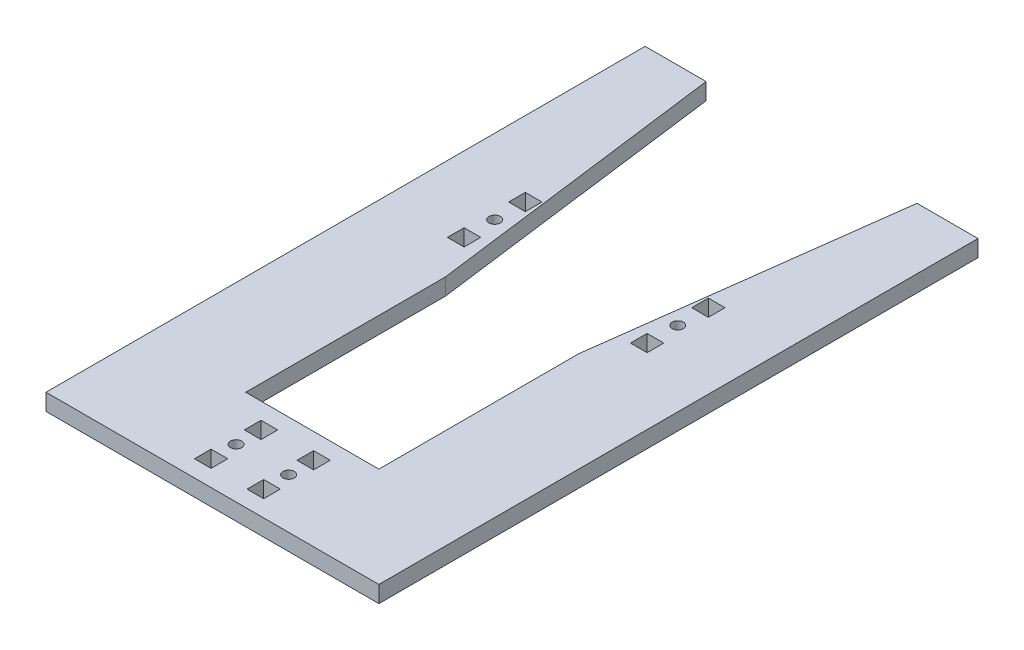
from build123d import *

# Parameters (mm, degrees)
BOTTOM_PLATE_R      = 2.159
BOTTOM_PLATE_R_2    = 2.794
BOTTOM_PLATE_W      = 25.4
BOTTOM_PLATE_H      = 101.6
BOTTOM_PLATE_W_2    = 6.35
BOTTOM_PLATE_H_2    = 6.35
BOSS_EXTRUDE1_DEPTH = 6.35
SKETCH1_W           = 508
SKETCH1_H           = 508
SKETCH1_W_2         = 127
SKETCH1_H_2         = 228.6
CUT_EXTRUDE1_DEPTH  = 25.4


with BuildPart() as part:
    # Bottom Plate → Boss-Extrude1 (new body)
    # profile 1 of 3: a face of its own
    with BuildSketch(Plane(origin=(0, 0, 0), x_dir=(1, 0, 0), z_dir=(0, 1, 0))):
        with BuildLine():
            Line((25.4, 0), (47.625, 171.302946195))
            ThreePointArc((47.625, 171.302946195), (0, -177.8), (-47.625, 171.302946195))
            Line((-47.625, 171.302946195), (-25.4, 0))
            Line((-25.4, 0), (-25.4, -76.2))
            Line((-25.4, -76.2), (25.4, -76.2))
            Line((25.4, -76.2), (25.4, 0))
        make_face()
        with Locations((128.515324336, 72.009)):
            Circle(BOTTOM_PLATE_R, mode=Mode.SUBTRACT)
        with Locations((128.515324336, -72.009)):
            Circle(BOTTOM_PLATE_R, mode=Mode.SUBTRACT)
        with Locations((54.082553747, 147.04477289)):
            Circle(BOTTOM_PLATE_R, mode=Mode.SUBTRACT)
        with Locations(Location((34.925, 28.321, 0), (0, 0, 270))):
            Circle(BOTTOM_PLATE_R, mode=Mode.SUBTRACT)
        with Locations(Location((-10.033, -95.25, 0), (0, 0, 270))):
            Circle(BOTTOM_PLATE_R, mode=Mode.SUBTRACT)
        with Locations((27.813, -127)):
            Circle(BOTTOM_PLATE_R_2, mode=Mode.SUBTRACT)
        with Locations((-27.813, -127)):
            Circle(BOTTOM_PLATE_R_2, mode=Mode.SUBTRACT)
        with Locations(Location((10.033, -95.25, 0), (0, 0, 90))):
            Circle(BOTTOM_PLATE_R, mode=Mode.SUBTRACT)
        with Locations(Location((-34.925, 28.321, 0), (0, 0, 90))):
            Circle(BOTTOM_PLATE_R, mode=Mode.SUBTRACT)
        with Locations((-128.515324336, -72.009)):
            Circle(BOTTOM_PLATE_R, mode=Mode.SUBTRACT)
        with Locations((-128.515324336, 72.009)):
            Circle(BOTTOM_PLATE_R, mode=Mode.SUBTRACT)
        with Locations((-54.082553747, 147.04477289)):
            Circle(BOTTOM_PLATE_R, mode=Mode.SUBTRACT)
        with Locations((144.390324336, 0)):
            Rectangle(BOTTOM_PLATE_W, BOTTOM_PLATE_H, mode=Mode.SUBTRACT)
        with Locations((-34.925, 40.005)):
            Rectangle(BOTTOM_PLATE_W_2, BOTTOM_PLATE_H_2, mode=Mode.SUBTRACT)
        with Locations((34.925, 16.637)):
            Rectangle(BOTTOM_PLATE_W_2, BOTTOM_PLATE_H_2, mode=Mode.SUBTRACT)
        with Locations((34.925, 40.005)):
            Rectangle(BOTTOM_PLATE_W_2, BOTTOM_PLATE_H_2, mode=Mode.SUBTRACT)
        with Locations((128.515324336, -60.325)):
            Rectangle(BOTTOM_PLATE_W_2, BOTTOM_PLATE_H_2, mode=Mode.SUBTRACT)
        with Locations((128.515324336, 60.325)):
            Rectangle(BOTTOM_PLATE_W_2, BOTTOM_PLATE_H_2, mode=Mode.SUBTRACT)
        with Locations((-34.925, 16.637)):
            Rectangle(BOTTOM_PLATE_W_2, BOTTOM_PLATE_H_2, mode=Mode.SUBTRACT)
        with Locations((-10.033, -85.725)):
            Rectangle(BOTTOM_PLATE_W_2, BOTTOM_PLATE_H_2, mode=Mode.SUBTRACT)
        with Locations((-10.033, -104.775)):
            Rectangle(BOTTOM_PLATE_W_2, BOTTOM_PLATE_H_2, mode=Mode.SUBTRACT)
        with Locations((10.033, -104.775)):
            Rectangle(BOTTOM_PLATE_W_2, BOTTOM_PLATE_H_2, mode=Mode.SUBTRACT)
        with Locations((10.033, -85.725)):
            Rectangle(BOTTOM_PLATE_W_2, BOTTOM_PLATE_H_2, mode=Mode.SUBTRACT)
        with Locations((-144.390324336, 0)):
            Rectangle(BOTTOM_PLATE_W, BOTTOM_PLATE_H, mode=Mode.SUBTRACT)
        with Locations((-128.515324336, -60.325)):
            Rectangle(BOTTOM_PLATE_W_2, BOTTOM_PLATE_H_2, mode=Mode.SUBTRACT)
        with Locations((-128.515324336, 60.325)):
            Rectangle(BOTTOM_PLATE_W_2, BOTTOM_PLATE_H_2, mode=Mode.SUBTRACT)
    # profile 2 of 3: a face of its own
    with BuildSketch(Plane(origin=(0, 0, 0), x_dir=(1, 0, 0), z_dir=(0, 1, 0))):
        Polygon((52.518937038, 159.669886307), (58.816158581, 158.852879058), (59.63316583, 165.1501006), (53.335944287, 165.967107849), align=None)
    # profile 3 of 3: a face of its own
    with BuildSketch(Plane(origin=(0, 0, 0), x_dir=(1, 0, 0), z_dir=(0, 1, 0))):
        Polygon((-58.816158581, 158.852879058), (-59.63316583, 165.1501006), (-53.335944287, 165.967107849), (-52.518937038, 159.669886307), align=None)
    extrude(amount=-BOSS_EXTRUDE1_DEPTH)

    # Sketch1 → Cut-Extrude1 (cut)
    with BuildSketch(Plane(origin=(0, 0, 0), x_dir=(1, 0, 0), z_dir=(0, 1, 0))):
        Rectangle(SKETCH1_W, SKETCH1_H)
        Rectangle(SKETCH1_W_2, SKETCH1_H_2, mode=Mode.SUBTRACT)
    extrude(amount=-CUT_EXTRUDE1_DEPTH, mode=Mode.SUBTRACT)


solid = part.part
